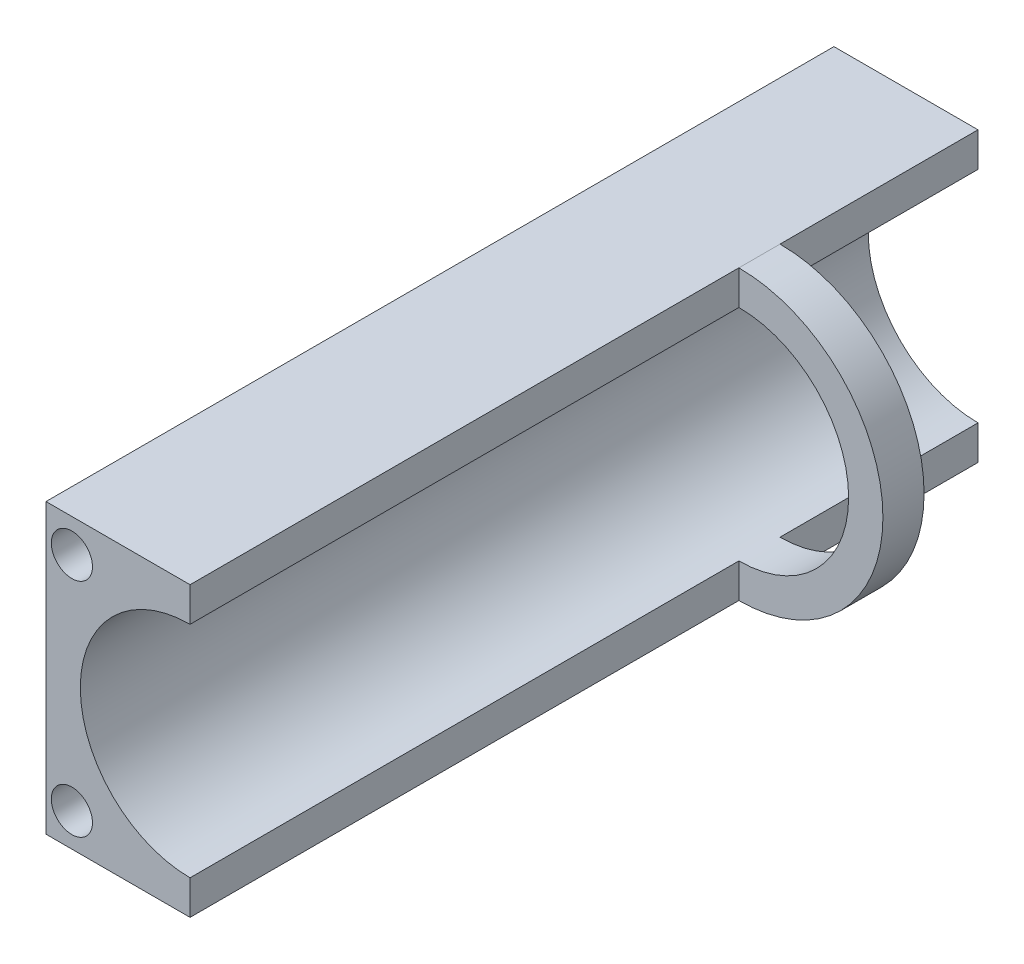
from build123d import *

# Parameters (mm, degrees)
BOSS_EXTRUDE1_DEPTH       = 57.43
SKETCH2_W                 = 3
SKETCH2_H                 = 2.5
SKETCH6_R                 = 1.5
CUT_EXTRUDE1_DEPTH        = 0.1
CUT_EXTRUDE2_START        = -0.1
SKETCH9_R                 = 1.5
CUT_EXTRUDE2_DEPTH        = 0.1
F_3_0MM_DOWEL_HOLE1_D     = 3
F_3_0MM_DOWEL_HOLE1_DEPTH = 3
F_3_0MM_DOWEL_HOLE1_TIP   = 0.901290929
F_3_0MM_DOWEL_HOLE2_D     = 3
F_3_0MM_DOWEL_HOLE2_DEPTH = 3
F_3_0MM_DOWEL_HOLE2_TIP   = 0.901290929


with BuildPart() as part:
    # Sketch1 → Boss-Extrude1 (new body)
    with BuildSketch(Plane.XY):
        with BuildLine():
            Line((0, -8), (0, -10.5))
            Line((0, -10.5), (-10.5, -10.5))
            Line((-10.5, -10.5), (-10.5, 10.5))
            Line((-10.5, 10.5), (0, 10.5))
            Line((0, 10.5), (0, 8))
            ThreePointArc((0, 8), (-8, 0), (0, -8))
        make_face()
    extrude(amount=BOSS_EXTRUDE1_DEPTH)

    # Sketch2 → Revolve1 (revolve)
    with BuildSketch(Plane(origin=(0, 0, 0), x_dir=(0, 0, -1), z_dir=(1, 0, 0)), mode=Mode.PRIVATE) as revolve1_sk:
        with Locations((-15.93, -9.25)):
            Rectangle(SKETCH2_W, SKETCH2_H)
    revolve(revolve1_sk.sketch.rotate(Axis((0, 0, 0), (0, 0, 1)), 180), axis=Axis((0, 0, 0), (0, 0, 1)))

    # Sketch6 → Cut-Extrude1 (cut)
    with BuildSketch(Plane.XY.offset(57.43)):
        with Locations((-8.613344298, 8.08)):
            Circle(SKETCH6_R)
        with Locations((-8.613344298, -8.08)):
            Circle(SKETCH6_R)
    extrude(amount=-CUT_EXTRUDE1_DEPTH, mode=Mode.SUBTRACT)

    # Sketch9 → Cut-Extrude2 (cut)
    with BuildSketch(Plane(origin=(0, 0, 0), x_dir=(-1, 0, 0), z_dir=(0, 0, -1)).offset(CUT_EXTRUDE2_START)):
        with Locations(Location((8.613344298, 8.08, 0), (0, 0, 180))):
            Circle(SKETCH9_R)
        with Locations(Location((8.613344298, -8.08, 0), (0, 0, 180))):
            Circle(SKETCH9_R)
    extrude(amount=CUT_EXTRUDE2_DEPTH, mode=Mode.SUBTRACT)

    # Ø3.0mm Dowel Hole1
    with Locations(Plane.XY.offset(57.43)):
        with Locations((-8.613344298, 8.08), (-8.613344298, -8.08)):
            Hole(F_3_0MM_DOWEL_HOLE1_D / 2, depth=F_3_0MM_DOWEL_HOLE1_DEPTH)
            with Locations((0, 0, -(F_3_0MM_DOWEL_HOLE1_DEPTH + F_3_0MM_DOWEL_HOLE1_TIP / 2))):  # 118° drill point
                Cone(0, F_3_0MM_DOWEL_HOLE1_D / 2, F_3_0MM_DOWEL_HOLE1_TIP, mode=Mode.SUBTRACT)

    # Ø3.0mm Dowel Hole2
    with Locations(Plane(origin=(0, 0, 0), x_dir=(-1, 0, 0), z_dir=(0, 0, -1))):
        with Locations((8.613344298, 8.08), (8.613344298, -8.08)):
            Hole(F_3_0MM_DOWEL_HOLE2_D / 2, depth=F_3_0MM_DOWEL_HOLE2_DEPTH)
            with Locations((0, 0, -(F_3_0MM_DOWEL_HOLE2_DEPTH + F_3_0MM_DOWEL_HOLE2_TIP / 2))):  # 118° drill point
                Cone(0, F_3_0MM_DOWEL_HOLE2_D / 2, F_3_0MM_DOWEL_HOLE2_TIP, mode=Mode.SUBTRACT)


solid = part.part
